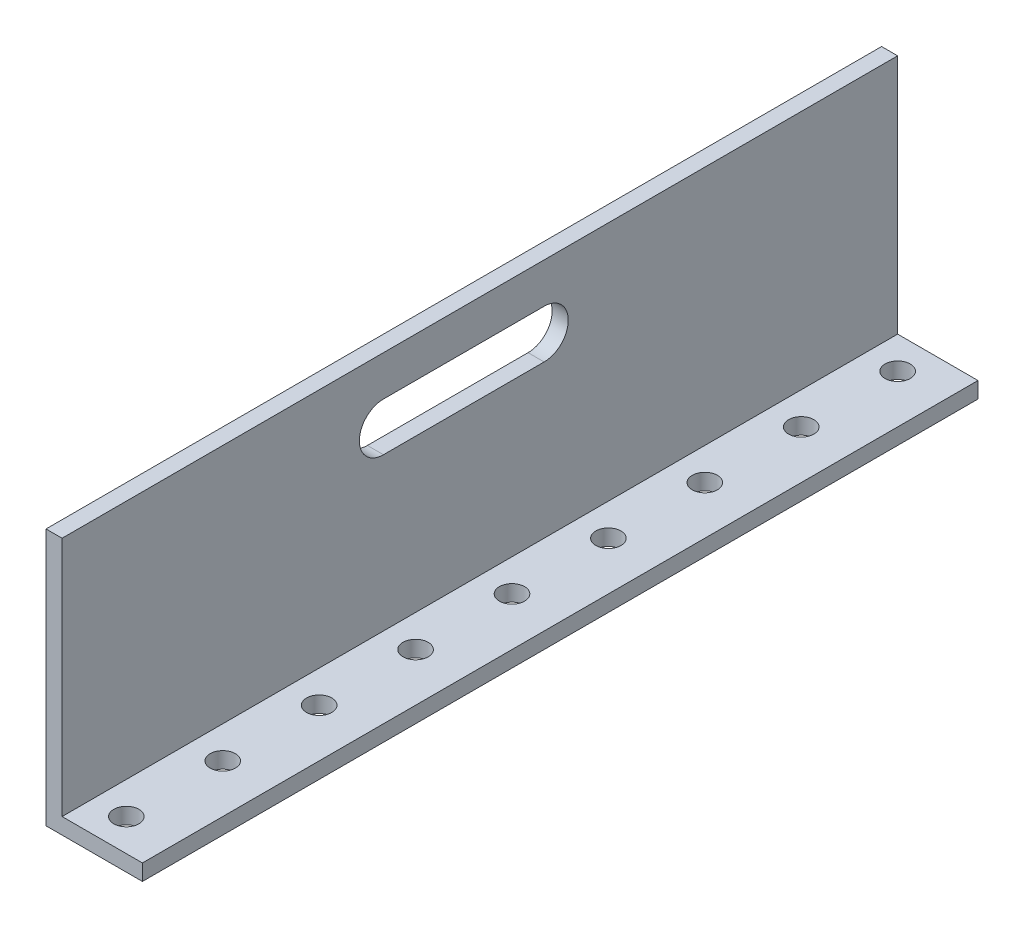
from build123d import *

# Parameters (mm, degrees)
SKETCH3_W           = 3.175
SKETCH3_H           = 47.625
SKETCH3_H_2         = 3.175
SKETCH3_W_2         = 15.875
BOSS_EXTRUDE1_DEPTH = 165.1
SKETCH4_R           = 2.4892
CUT_EXTRUDE1_DEPTH  = 165.1
CUT_EXTRUDE2_DEPTH  = 165.1


with BuildPart() as part:
    # Sketch3 → Boss-Extrude1 (new body)
    with BuildSketch(Plane.XY):
        with Locations((1.5875, 26.9875)):
            Rectangle(SKETCH3_W, SKETCH3_H)
        with Locations((1.5875, 1.5875)):
            Rectangle(SKETCH3_W, SKETCH3_H_2)
        with Locations((11.1125, 1.5875)):
            Rectangle(SKETCH3_W_2, SKETCH3_H_2)
    extrude(amount=BOSS_EXTRUDE1_DEPTH)

    # Sketch4 → Cut-Extrude1 (cut)
    with BuildSketch(Plane(origin=(0, 3.175, 0), x_dir=(1, 0, 0), z_dir=(0, 1, 0))):
        with Locations(Location((9.525, -6.35, 0), (0, 0, 270))):
            Circle(SKETCH4_R)
        with Locations(Location((9.525, -25.4, 0), (0, 0, 270))):
            Circle(SKETCH4_R)
        with Locations(Location((9.525, -44.45, 0), (0, 0, 270))):
            Circle(SKETCH4_R)
        with Locations(Location((9.525, -63.5, 0), (0, 0, 270))):
            Circle(SKETCH4_R)
        with Locations(Location((9.525, -82.55, 0), (0, 0, 270))):
            Circle(SKETCH4_R)
        with Locations(Location((9.525, -101.6, 0), (0, 0, 270))):
            Circle(SKETCH4_R)
        with Locations(Location((9.525, -120.65, 0), (0, 0, 270))):
            Circle(SKETCH4_R)
        with Locations(Location((9.525, -139.7, 0), (0, 0, 270))):
            Circle(SKETCH4_R)
        with Locations(Location((9.525, -158.75, 0), (0, 0, 270))):
            Circle(SKETCH4_R)
    extrude(amount=-CUT_EXTRUDE1_DEPTH, mode=Mode.SUBTRACT)

    # Sketch5 → Cut-Extrude2 (cut)
    with BuildSketch(Plane.ZY):
        with BuildLine():
            Line((69.85, 42.8625), (101.6, 42.8625))
            ThreePointArc((101.6, 42.8625), (106.3625, 38.1), (101.6, 33.3375))
            Line((101.6, 33.3375), (69.85, 33.3375))
            ThreePointArc((69.85, 33.3375), (65.0875, 38.1), (69.85, 42.8625))
        make_face()
    extrude(amount=-CUT_EXTRUDE2_DEPTH, mode=Mode.SUBTRACT)


solid = part.part
